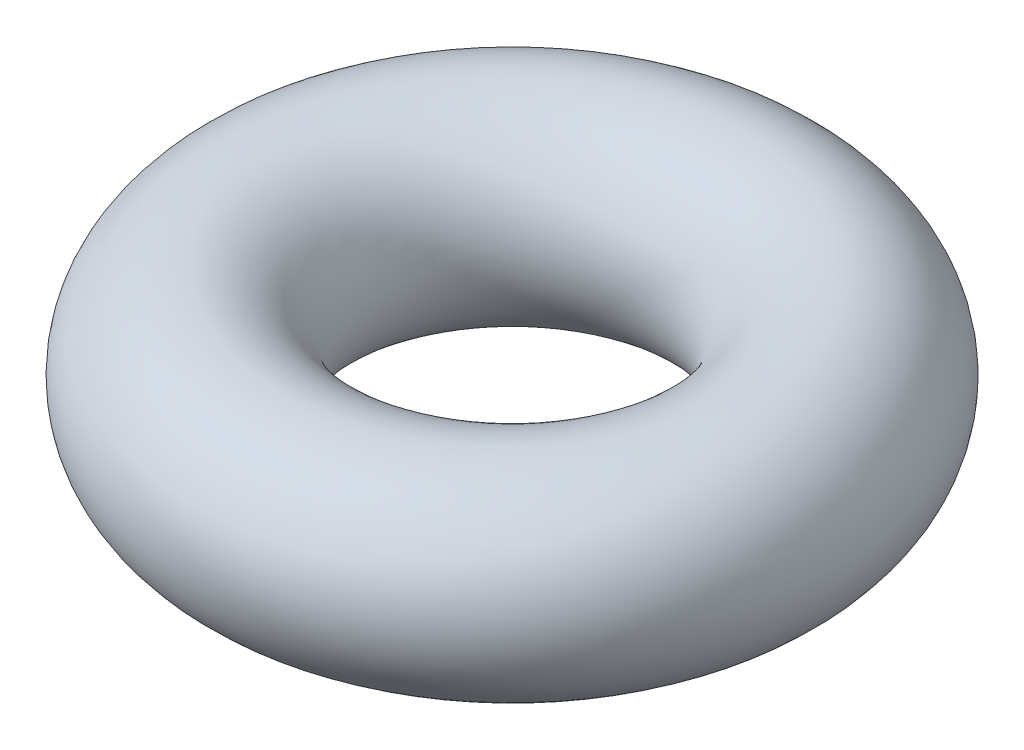
from build123d import *

# Parameters (mm, degrees)
MAINBODYS_R = 0.75


with BuildPart() as part:
    # MainBodyS → MAIN BODY (revolve)
    with BuildSketch(Plane.XY):
        with Locations((1.75, 0)):
            Circle(MAINBODYS_R)
    revolve(axis=Axis((0, 0, 0), (0, -1, 0)))


solid = part.part
